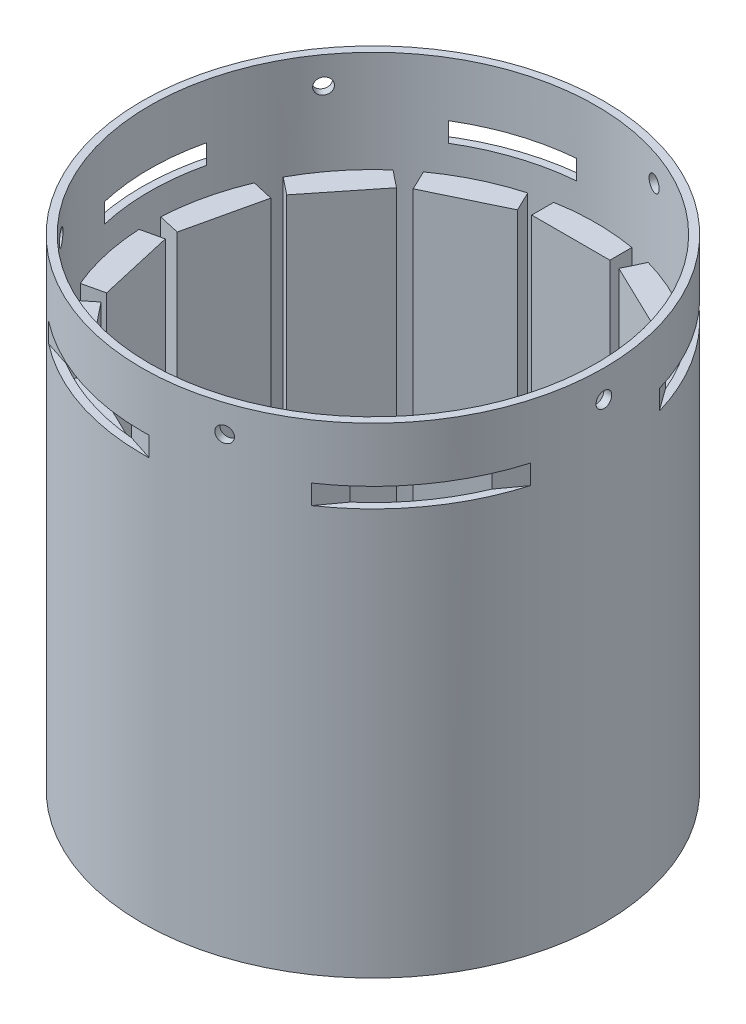
from build123d import *

# Parameters (mm, degrees)
SKETCH1_R           = 29.575
SKETCH1_R_2         = 28.575
BOSS_EXTRUDE1_DEPTH = 61.5
BOSS_EXTRUDE2_START = 2.5
BOSS_EXTRUDE2_DEPTH = 46.5
CIRPATTERN1_COUNT   = 14
SKETCH4_W           = 1.75
SKETCH4_H           = 2.5
CUT_EXTRUDE1_DEPTH  = 91.308654762
CIRPATTERN2_COUNT   = 5
SKETCH5_R           = 1
CUT_EXTRUDE2_DEPTH  = 5
CIRPATTERN3_COUNT   = 5


with BuildPart() as part:
    # Sketch1 → Boss-Extrude1 (new body)
    with BuildSketch(Plane(origin=(0, 0, 0), x_dir=(1, 0, 0), z_dir=(0, 1, 0))):
        with Locations(Location((0, 0, 0), (0, 0, 270))):
            Circle(SKETCH1_R)
        with Locations(Location((0, 0, 0), (0, 0, 270))):
            Circle(SKETCH1_R_2, mode=Mode.SUBTRACT)
    extrude(amount=BOSS_EXTRUDE1_DEPTH)

    # Sketch2 → Boss-Extrude2 (add)
    with BuildSketch(Plane(origin=(0, 4.5, 0), x_dir=(-1, 0, 0), z_dir=(0, -1, 0)).offset(BOSS_EXTRUDE2_START)):
        with BuildLine():
            Line((-5, 28.134154066), (-5, 25.325))
            Line((-5, 25.325), (5, 25.325))
            Line((5, 25.325), (5, 28.134154066))
            ThreePointArc((5, 28.134154066), (2.509698445, 28.464575154), (0, 28.575))
            ThreePointArc((0, 28.575), (-2.509698445, 28.464575154), (-5, 28.134154066))
        make_face()
    boss_extrude2 = extrude(amount=-BOSS_EXTRUDE2_DEPTH)

    # CirPattern1: Boss-Extrude2 ×14 about axis
    cirpattern1_axis = Axis((0, 0, 0), (0, 1, 0))
    for i in range(1, CIRPATTERN1_COUNT):
        add(boss_extrude2.rotate(cirpattern1_axis, i * 360 / CIRPATTERN1_COUNT))

    # Sketch4 → Cut-Extrude1 (cut, through all)
    with BuildSketch(Plane.XY.offset(29.575)):
        with Locations((-28.7, 53.25)):
            Rectangle(SKETCH4_W, SKETCH4_H)
    cut_extrude1 = extrude(amount=-CUT_EXTRUDE1_DEPTH, mode=Mode.SUBTRACT)

    # CirPattern2: Cut-Extrude1 ×5 about axis
    cirpattern2_axis = Axis((0, 0, 0), (0, 1, 0))
    for i in range(1, CIRPATTERN2_COUNT):
        add(cut_extrude1.rotate(cirpattern2_axis, i * 360 / CIRPATTERN2_COUNT), mode=Mode.SUBTRACT)

    # Sketch5 → Cut-Extrude2 (cut, symmetric)
    with BuildSketch(Plane(origin=(8.776688534, 0, 27.011869813), x_dir=(-0.9510565162951524, 0, 0.30901699437495134), z_dir=(-0.30901699437495134, 0, -0.9510565162951524))):
        with Locations(Location((0, 58, 0), (0, 0, 180))):
            Circle(SKETCH5_R)
    cut_extrude2 = extrude(amount=CUT_EXTRUDE2_DEPTH, both=True, mode=Mode.SUBTRACT)

    # CirPattern3: Cut-Extrude2 ×5 about axis
    cirpattern3_axis = Axis((0, 0, 0), (0, 1, 0))
    for i in range(1, CIRPATTERN3_COUNT):
        add(cut_extrude2.rotate(cirpattern3_axis, i * 360 / CIRPATTERN3_COUNT), mode=Mode.SUBTRACT)


solid = part.part
